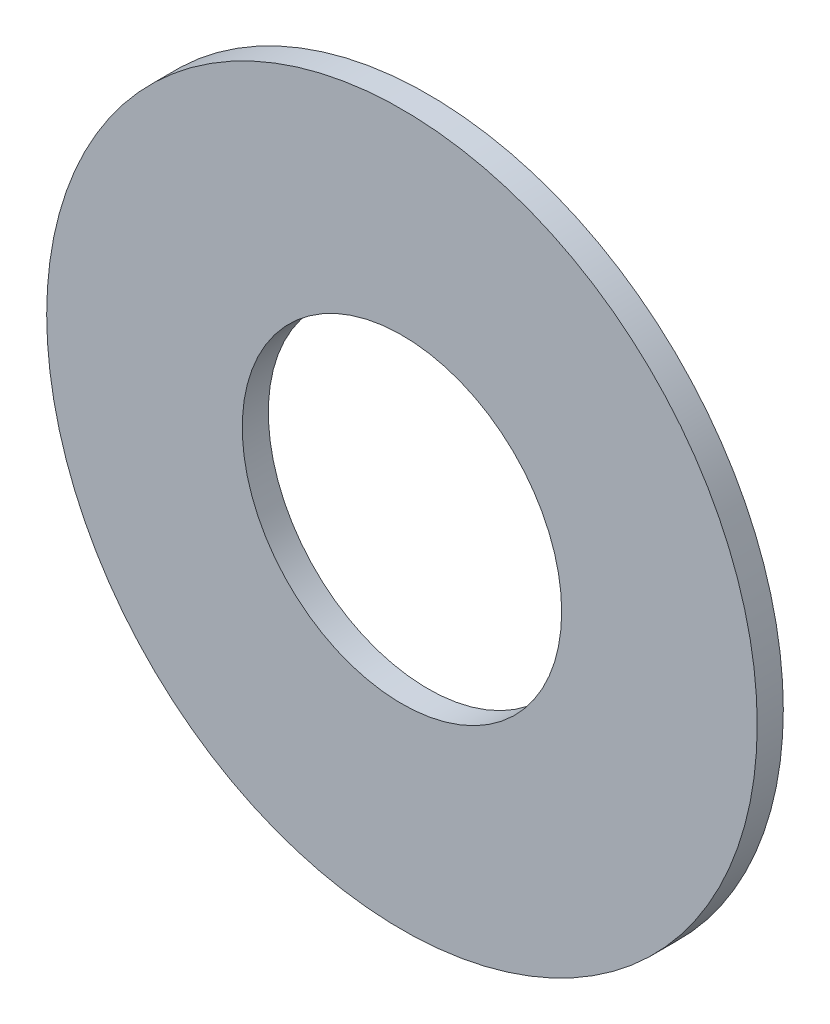
from build123d import *

# Parameters (mm, degrees)
SKETCH_1_R      = 10.9
SKETCH_1_R_2    = 4.9
EXTRUDE_1_DEPTH = 0.8


with BuildPart() as part:
    # Эскиз1 → Бобышка-Вытянуть1 (new body)
    with BuildSketch(Plane.XY):
        Circle(SKETCH_1_R)
        Circle(SKETCH_1_R_2, mode=Mode.SUBTRACT)
    extrude(amount=EXTRUDE_1_DEPTH)


solid = part.part
